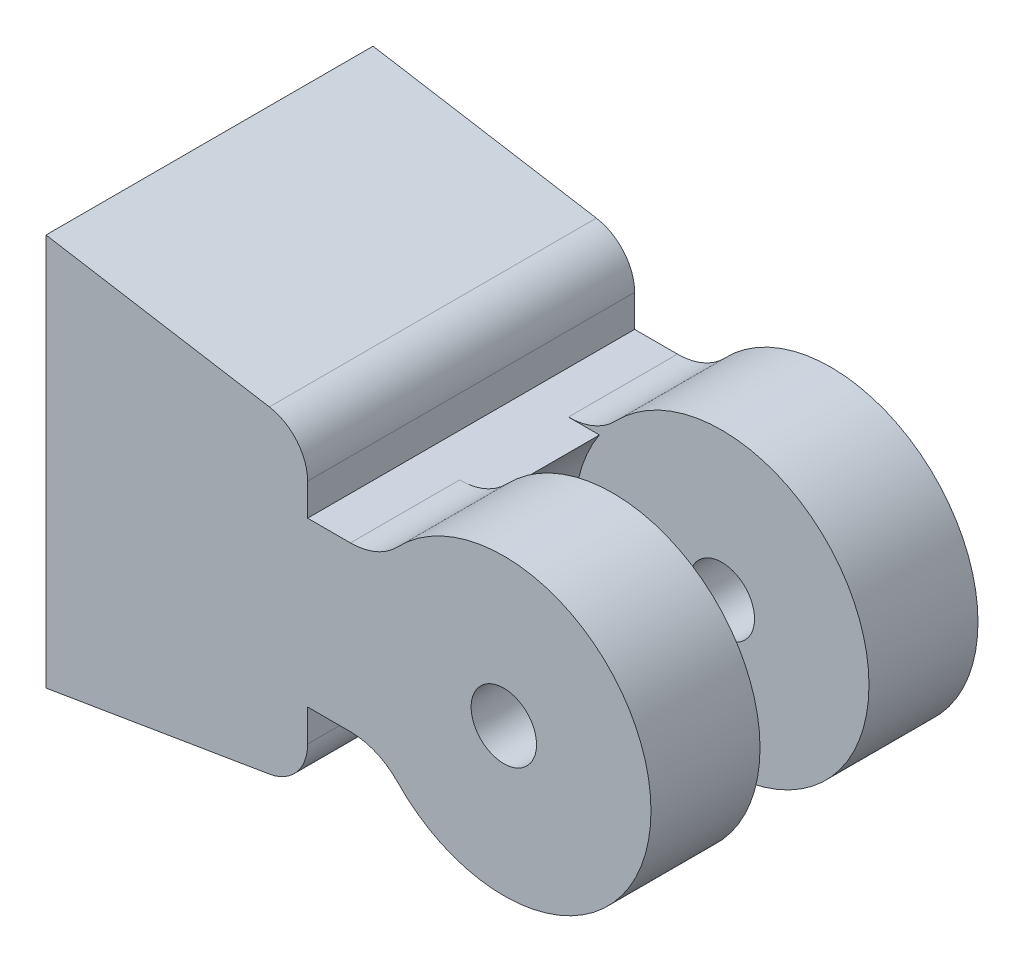
from build123d import *

# Parameters (mm, degrees)
BOSS_EXTRUDE1_DEPTH = 50
BOSS_EXTRUDE2_DEPTH = 25
CUT_EXTRUDE1_START  = -8.33
SKETCH3_R           = 22.5
CUT_EXTRUDE1_DEPTH  = 8.33
FILLET1_R           = 10
FILLET2_R           = 7
SKETCH4_R           = 10
CUT_EXTRUDE2_DEPTH  = 20


with BuildPart() as part:
    # Sketch1 → Boss-Extrude1 (new body)
    with BuildSketch(Plane.XY):
        Polygon((0, 30), (0, -30), (40, -23.334999563), (40, 23.334999563), align=None)
    extrude(amount=BOSS_EXTRUDE1_DEPTH)

    # Sketch2 → Boss-Extrude2 (add)
    with BuildSketch(Plane.XY):
        with BuildLine():
            Line((40, 0), (47.5, 0))
            ThreePointArc((47.5, 0), (48.4687848, 6.5312152), (51.291713066, 12.5))
            Line((51.291713066, 12.5), (40, 12.5))
            Line((40, 12.5), (40, 0))
        make_face()
        with BuildLine():
            Line((40, -12.5), (51.291713066, -12.5))
            ThreePointArc((51.291713066, -12.5), (48.4687848, -6.5312152), (47.5, 0))
            Line((47.5, 0), (40, 0))
            Line((40, 0), (40, -12.5))
        make_face()
        with BuildLine():
            ThreePointArc((47.5, 0), (48.4687848, -6.5312152), (51.291713066, -12.5))
            ThreePointArc((51.291713066, -12.5), (76.5312152, -21.5312152), (92.5, 0))
            Line((92.5, 0), (75, 0))
            ThreePointArc((75, 0), (70, -5), (65, 0))
            Line((65, 0), (47.5, 0))
        make_face()
        with BuildLine():
            Line((75, 0), (92.5, 0))
            ThreePointArc((92.5, 0), (76.5312152, 21.5312152), (51.291713066, 12.5))
            ThreePointArc((51.291713066, 12.5), (48.4687848, 6.5312152), (47.5, 0))
            Line((47.5, 0), (65, 0))
            ThreePointArc((65, 0), (70, 5), (75, 0))
        make_face()
    boss_extrude2 = extrude(amount=BOSS_EXTRUDE2_DEPTH)

    # Sketch3 → Cut-Extrude1 (cut)
    with BuildSketch(Plane.XY.offset(25).offset(CUT_EXTRUDE1_START)):
        with Locations((70, 0)):
            Circle(SKETCH3_R)
    cut_extrude1 = extrude(amount=CUT_EXTRUDE1_DEPTH, mode=Mode.SUBTRACT)

    # Mirror1: Boss-Extrude2, Cut-Extrude1 across plane
    add(boss_extrude2.mirror(Plane.XY.offset(25)))
    add(cut_extrude1.mirror(Plane.XY.offset(25)), mode=Mode.SUBTRACT)

    # Fillet1
    fillet1_edges = [part.edges().sort_by_distance(p)[0] for p in [
        (51.291713066, 12.5, 8.335),
        (51.291713066, -12.5, 8.335),
        (51.291713066, -12.5, 41.665),
        (51.291713066, 12.5, 41.665),
    ]]
    fillet(fillet1_edges, radius=FILLET1_R)

    # Fillet2
    fillet2_edges = [part.edges().sort_by_distance(p)[0] for p in [
        (40, 23.334999563, 25),
        (40, -23.334999563, 25),
    ]]
    fillet(fillet2_edges, radius=FILLET2_R)

    # Sketch4 → Cut-Extrude2 (cut)
    with BuildSketch(Plane.ZY):
        with Locations((25, 0)):
            Circle(SKETCH4_R)
    extrude(amount=-CUT_EXTRUDE2_DEPTH, mode=Mode.SUBTRACT)


solid = part.part
